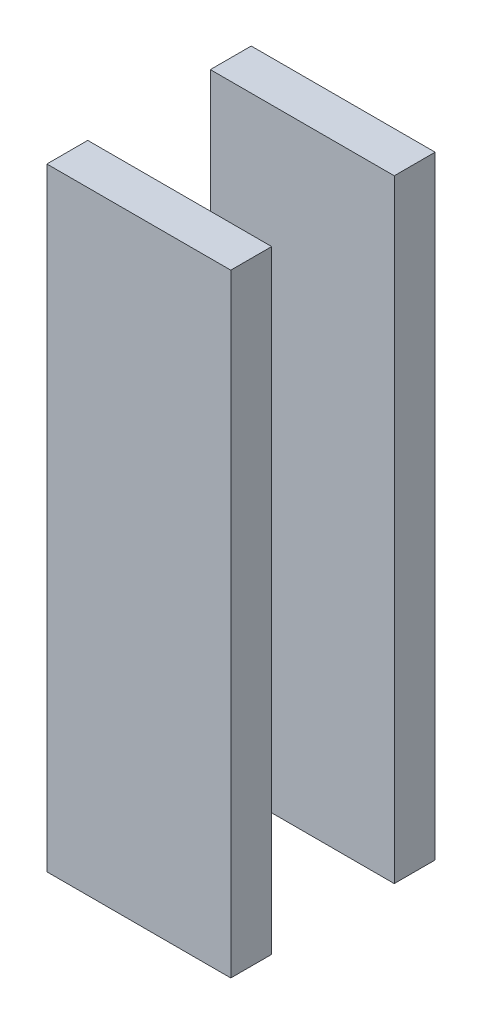
from build123d import *

# Parameters (mm, degrees)
SKETCH_1_W        = 45
SKETCH_1_H        = 10
EXTRUDE_1_DEPTH   = 150
EXTRUDE_1_2_DEPTH = 150


with BuildPart() as part:
    # 草图1 → 凸台-拉伸1 (new body)
    with BuildSketch(Plane(origin=(0, 0, 0), x_dir=(1, 0, 0), z_dir=(0, 1, 0))):
        with Locations((10.977088949, 40.363881402)):
            Rectangle(SKETCH_1_W, SKETCH_1_H)
    extrude(amount=EXTRUDE_1_DEPTH)


with BuildPart() as body_2:
    # 草图1 → Extrude 1 2 (new body)
    with BuildSketch(Plane(origin=(0, 0, 0), x_dir=(1, 0, 0), z_dir=(0, 1, 0))):
        with Locations((10.977088949, 0.363881402)):
            Rectangle(SKETCH_1_W, SKETCH_1_H)
    extrude(amount=EXTRUDE_1_2_DEPTH)


solid = Compound([part.part, body_2.part])
